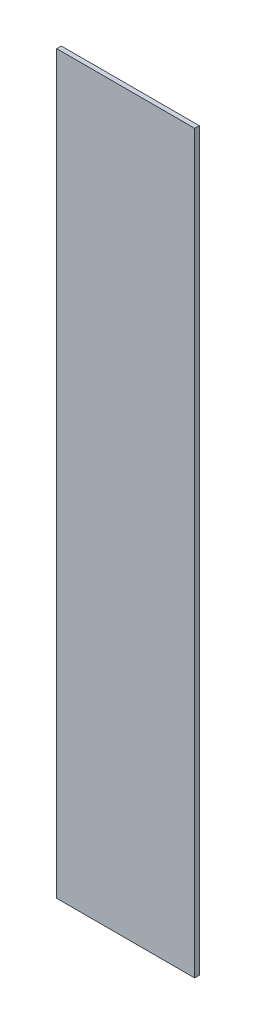
from build123d import *

# Parameters (mm, degrees)
ESQUISSE1_W        = 150
ESQUISSE1_H        = 800
BOSS_EXTRU_1_DEPTH = 5


with BuildPart() as part:
    # Esquisse1 → Boss.-Extru.1 (new body)
    with BuildSketch(Plane.XY):
        Rectangle(ESQUISSE1_W, ESQUISSE1_H)
    extrude(amount=BOSS_EXTRU_1_DEPTH)


solid = part.part
